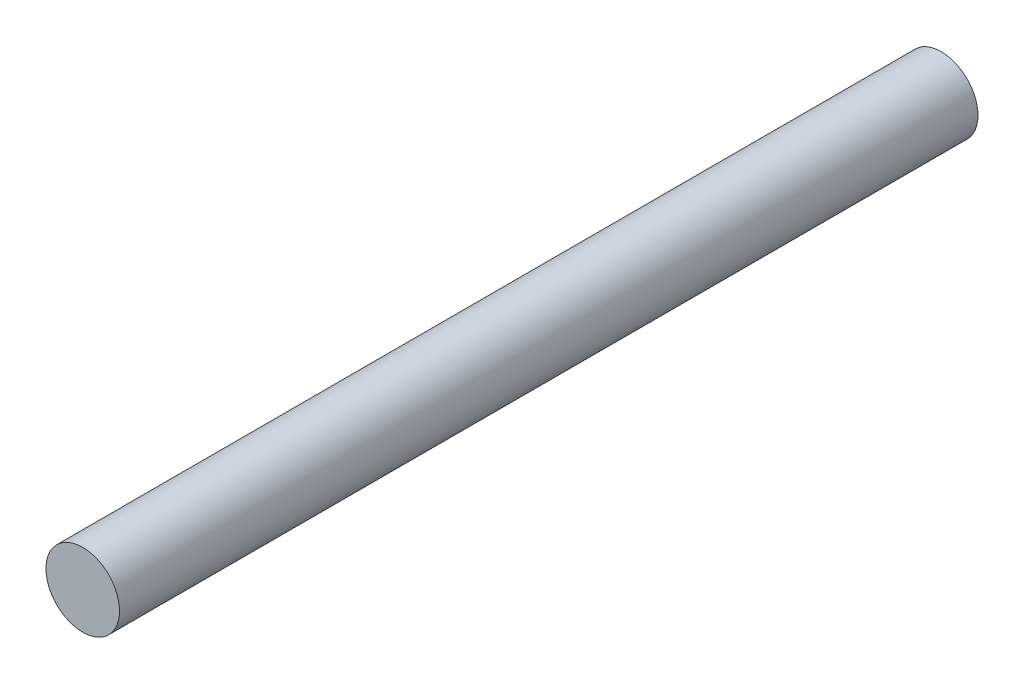
from build123d import *

# Parameters (mm, degrees)
CROQUIS1_R              = 1.5
SALIENTE_EXTRUIR1_DEPTH = 35


with BuildPart() as part:
    # Croquis1 → Saliente-Extruir1 (new body)
    with BuildSketch(Plane.XY):
        Circle(CROQUIS1_R)
    extrude(amount=SALIENTE_EXTRUIR1_DEPTH)


solid = part.part
